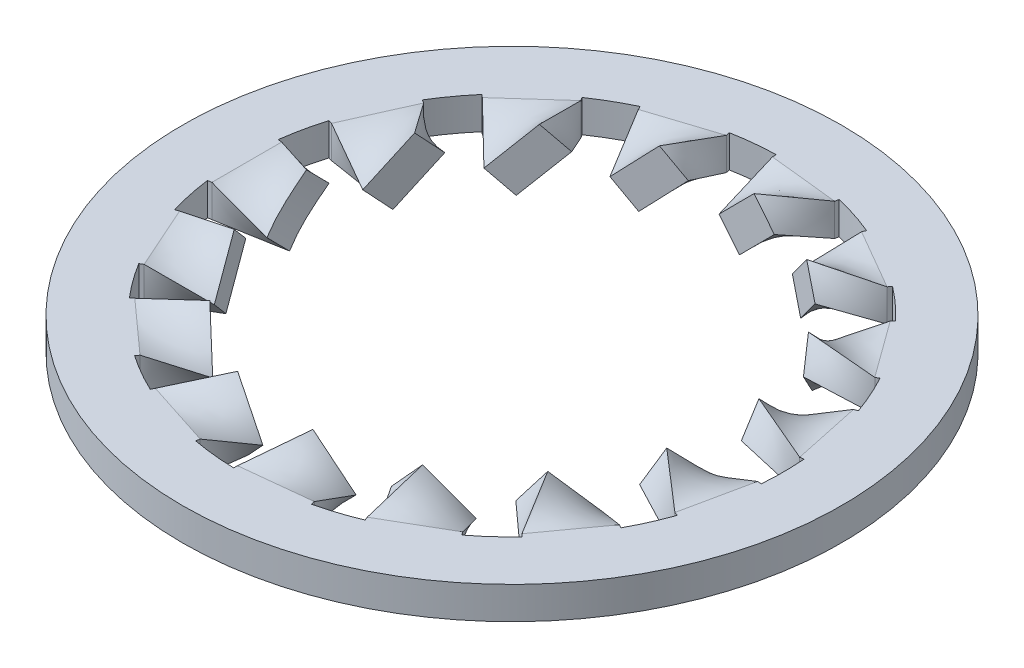
from build123d import *

# Parameters (mm, degrees)
SKETCH2_R           = 5.1
BOSS_EXTRUDE1_DEPTH = 0.25
SKETCH7_R           = 3.33942952
CUT_EXTRUDE2_DEPTH  = 0.3
CIRPATTERN1_COUNT   = 15


with BuildPart() as part:
    # Sketch2 → Boss-Extrude1 (new, symmetric)
    with BuildSketch(Plane(origin=(0, 0, 0), x_dir=(1, 0, 0), z_dir=(0, 1, 0))):
        with Locations(Location((0, 0, 0), (0, 0, 270))):
            Circle(SKETCH2_R)
        with BuildLine():
            Line((-4.10463153, -0.54), (-4.10463153, 0.54))
            Line((-4.10463153, 0.54), (-4.164118944, 0.547826087))
            ThreePointArc((-4.164118944, 0.547826087), (-4.108219923, 0.873229101), (-4.02693289, 1.193235727))
            Line((-4.02693289, 1.193235727), (-3.969405277, 1.176189503))
            Line((-3.969405277, 1.176189503), (-3.530129703, 2.162818597))
            Line((-3.530129703, 2.162818597), (-3.581291003, 2.194163794))
            ThreePointArc((-3.581291003, 2.194163794), (-3.397871376, 2.46869806), (-3.193453556, 2.727976244))
            Line((-3.193453556, 2.727976244), (-3.147832791, 2.689005155))
            Line((-3.147832791, 2.689005155), (-2.345236379, 3.41166621))
            Line((-2.345236379, 3.41166621), (-2.379225312, 3.461110648))
            ThreePointArc((-2.379225312, 3.461110648), (-2.1, 3.637306696), (-1.80779709, 3.791024885))
            Line((-1.80779709, 3.791024885), (-1.781971417, 3.736867387))
            Line((-1.781971417, 3.736867387), (-0.75483038, 4.070605741))
            Line((-0.75483038, 4.070605741), (-0.76576995, 4.129600027))
            ThreePointArc((-0.76576995, 4.129600027), (-0.439019546, 4.176991961), (-0.109556084, 4.198570884))
            Line((-0.109556084, 4.198570884), (-0.107990997, 4.1385913))
            Line((-0.107990997, 4.1385913), (0.96609265, 4.025700559))
            Line((0.96609265, 4.025700559), (0.980093992, 4.084044046))
            ThreePointArc((0.980093992, 4.084044046), (1.297871376, 3.994437368), (1.607628164, 3.880145833))
            Line((1.607628164, 3.880145833), (1.584662047, 3.824715178))
            Line((1.584662047, 3.824715178), (2.519969483, 3.284715178))
            Line((2.519969483, 3.284715178), (2.55649078, 3.332319746))
            ThreePointArc((2.55649078, 3.332319746), (2.810348547, 3.121208267), (3.046838897, 2.890808318))
            Line((3.046838897, 2.890808318), (3.003312627, 2.849511057))
            Line((3.003312627, 2.849511057), (3.6381207, 1.975772703))
            Line((3.6381207, 1.975772703), (3.690847087, 2.00440709))
            ThreePointArc((3.690847087, 2.00440709), (3.836890922, 1.708293901), (3.959223506, 1.401623783))
            Line((3.959223506, 1.401623783), (3.90266317, 1.381600586))
            Line((3.90266317, 1.381600586), (4.127207796, 0.325201177))
            Line((4.127207796, 0.325201177), (4.187022402, 0.329914238))
            ThreePointArc((4.187022402, 0.329914238), (4.2, 0), (4.187022402, -0.329914238))
            Line((4.187022402, -0.329914238), (4.127207796, -0.325201177))
            Line((4.127207796, -0.325201177), (3.90266317, -1.381600586))
            Line((3.90266317, -1.381600586), (3.959223506, -1.401623783))
            ThreePointArc((3.959223506, -1.401623783), (3.836890922, -1.708293901), (3.690847087, -2.00440709))
            Line((3.690847087, -2.00440709), (3.6381207, -1.975772703))
            Line((3.6381207, -1.975772703), (3.003312627, -2.849511057))
            Line((3.003312627, -2.849511057), (3.046838897, -2.890808318))
            ThreePointArc((3.046838897, -2.890808318), (2.810348547, -3.121208267), (2.55649078, -3.332319746))
            Line((2.55649078, -3.332319746), (2.519969483, -3.284715178))
            Line((2.519969483, -3.284715178), (1.584662047, -3.824715178))
            Line((1.584662047, -3.824715178), (1.607628164, -3.880145833))
            ThreePointArc((1.607628164, -3.880145833), (1.297871376, -3.994437368), (0.980093992, -4.084044046))
            Line((0.980093992, -4.084044046), (0.96609265, -4.025700559))
            Line((0.96609265, -4.025700559), (-0.107990997, -4.1385913))
            Line((-0.107990997, -4.1385913), (-0.109556084, -4.198570884))
            ThreePointArc((-0.109556084, -4.198570884), (-0.439019546, -4.176991961), (-0.76576995, -4.129600027))
            Line((-0.76576995, -4.129600027), (-0.75483038, -4.070605741))
            Line((-0.75483038, -4.070605741), (-1.781971417, -3.736867387))
            Line((-1.781971417, -3.736867387), (-1.80779709, -3.791024885))
            ThreePointArc((-1.80779709, -3.791024885), (-2.1, -3.637306696), (-2.379225312, -3.461110648))
            Line((-2.379225312, -3.461110648), (-2.345236379, -3.41166621))
            Line((-2.345236379, -3.41166621), (-3.147832791, -2.689005155))
            Line((-3.147832791, -2.689005155), (-3.193453556, -2.727976244))
            ThreePointArc((-3.193453556, -2.727976244), (-3.397871376, -2.46869806), (-3.581291003, -2.194163794))
            Line((-3.581291003, -2.194163794), (-3.530129703, -2.162818597))
            Line((-3.530129703, -2.162818597), (-3.969405277, -1.176189503))
            Line((-3.969405277, -1.176189503), (-4.02693289, -1.193235727))
            ThreePointArc((-4.02693289, -1.193235727), (-4.108219923, -0.873229101), (-4.164118944, -0.547826087))
            Line((-4.164118944, -0.547826087), (-4.10463153, -0.54))
        make_face(mode=Mode.SUBTRACT)
    extrude(amount=BOSS_EXTRUDE1_DEPTH, both=True)

    # Sketch3 → Loft3 section 0
    with BuildSketch(Plane(origin=(-4.10463153, 0, 0), x_dir=(0, 0, -1), z_dir=(1, 0, 0))):
        with BuildLine():
            Line((0.54, -0.25), (-0.54, -0.25))
            Line((-0.54, -0.25), (-0.54, 0.25))
            Line((-0.54, 0.25), (0.54, 0.25))
            Line((0.54, 0.25), (0.54, -0.25))
        make_face()
    # Sketch6 → Loft3 section 1
    with BuildSketch(Plane(origin=(-3.30463153, 0, 0), x_dir=(0, 0, -1), z_dir=(1, 0, 0))):
        with BuildLine():
            Line((-0.127279221, -0.480832611), (0.480832611, 0.127279221))
            Line((0.480832611, 0.127279221), (0.127279221, 0.480832611))
            Line((0.127279221, 0.480832611), (-0.480832611, -0.127279221))
            Line((-0.480832611, -0.127279221), (-0.127279221, -0.480832611))
        make_face()
    loft3 = loft()

    # Sketch7 → Cut-Extrude2 (cut, symmetric)
    with BuildSketch(Plane(origin=(0, 0, 0), x_dir=(1, 0, 0), z_dir=(0, 0.7071067811865436, 0.7071067811865515))):
        Circle(SKETCH7_R)
    extrude(amount=CUT_EXTRUDE2_DEPTH, both=True, mode=Mode.SUBTRACT)

    # CirPattern1: Loft3 ×15 about axis
    cirpattern1_axis = Axis((0, 0.25, 0), (0, 1, 0))
    for i in range(1, CIRPATTERN1_COUNT):
        add(loft3.rotate(cirpattern1_axis, i * 360 / CIRPATTERN1_COUNT))


solid = part.part
